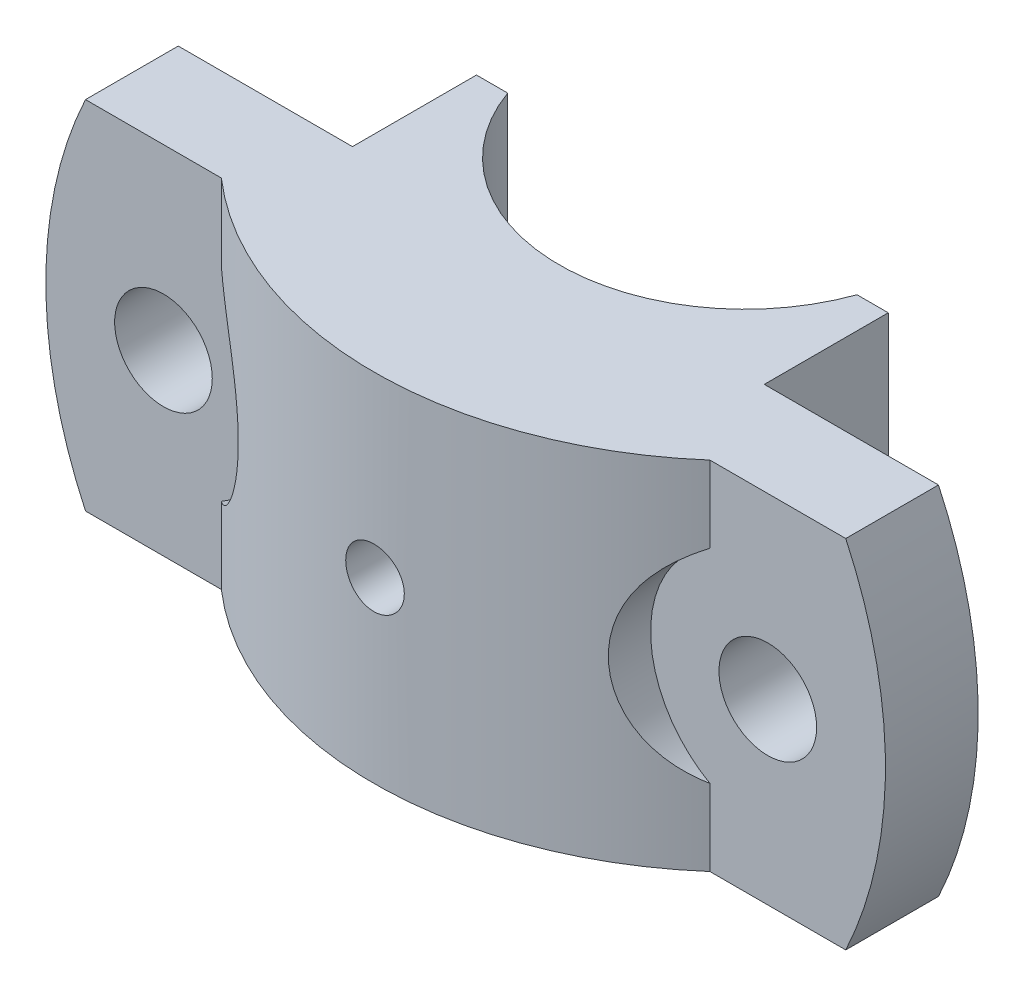
from build123d import *

# Parameters (mm, degrees)
BOSS_EXTRUDE1_DEPTH = 9.5
SKETCH4_R           = 5
CUT_EXTRUDE1_DEPTH  = 9.5
BOSS_EXTRUDE2_DEPTH = 36.5
SKETCH8_R           = 12
CUT_EXTRUDE2_DEPTH  = 52.719459587


with BuildPart() as part:
    # Sketch3 → Boss-Extrude1 (new body)
    with BuildSketch(Plane.XY):
        with BuildLine():
            Line((-38.935042057, 18.25), (38.935042057, 18.25))
            ThreePointArc((38.935042057, 18.25), (43, 0), (38.935042057, -18.25))
            Line((38.935042057, -18.25), (-38.935042057, -18.25))
            ThreePointArc((-38.935042057, -18.25), (-43, 0), (-38.935042057, 18.25))
        make_face()
    extrude(amount=BOSS_EXTRUDE1_DEPTH)

    # Sketch4 → Cut-Extrude1 (cut)
    with BuildSketch(Plane.XY.offset(9.5)):
        with Locations((-30.95, 0)):
            Circle(SKETCH4_R)
        with Locations((30.95, 0)):
            Circle(SKETCH4_R)
    extrude(amount=-CUT_EXTRUDE1_DEPTH, mode=Mode.SUBTRACT)

    # Sketch7 → Boss-Extrude2 (add)
    with BuildSketch(Plane.XZ.offset(18.25)):
        with BuildLine():
            Line((0, 0), (0, -0.1))
            ThreePointArc((0, -0.1), (-10.940749517, -3.566165959), (-17.889661819, -12.7))
            Line((-17.889661819, -12.7), (-21.089661819, -12.7))
            Line((-21.089661819, -12.7), (-21.089661819, 0))
            Line((-21.089661819, 0), (0, 0))
        make_face()
        with BuildLine():
            Line((0, 18.9), (0, 9.5))
            Line((0, 9.5), (-25.020791354, 9.5))
            ThreePointArc((-25.020791354, 9.5), (-13.364131098, 16.472461259), (0, 18.9))
        make_face()
    boss_extrude2 = extrude(amount=-BOSS_EXTRUDE2_DEPTH)

    # Mirror1: Boss-Extrude2 across plane
    add(boss_extrude2.mirror(Plane(origin=(0, 0, 0), x_dir=(0, 0, 1), z_dir=(1, 0, 0))))

    # Sketch8 → Cut-Extrude2 (cut, through all)
    with BuildSketch(Plane.XY.offset(9.5)):
        with Locations((-30.95, 0)):
            Circle(SKETCH8_R)
    cut_extrude2 = extrude(amount=CUT_EXTRUDE2_DEPTH, mode=Mode.SUBTRACT)

    # Mirror2: Cut-Extrude2 across plane
    add(cut_extrude2.mirror(Plane(origin=(0, 0, 0), x_dir=(0, 0, 1), z_dir=(1, 0, 0))), mode=Mode.SUBTRACT)

    # Sketch9 → Cut-Revolve1 (revolve, cut)
    with BuildSketch(Plane(origin=(0, 0, 0), x_dir=(0, 0, -1), z_dir=(1, 0, 0)), mode=Mode.PRIVATE) as cut_revolve1_sk:
        Polygon((-18.9, 0), (-18.9, 3), (0, 3), (0, 2), (13.728327228, 2), (13.728327228, 0), align=None)
    revolve(cut_revolve1_sk.sketch.rotate(Axis((0, 0, -13.728327228), (0, 0, 1)), 90), axis=Axis((0, 0, -13.728327228), (0, 0, 1)), mode=Mode.SUBTRACT)


solid = part.part
